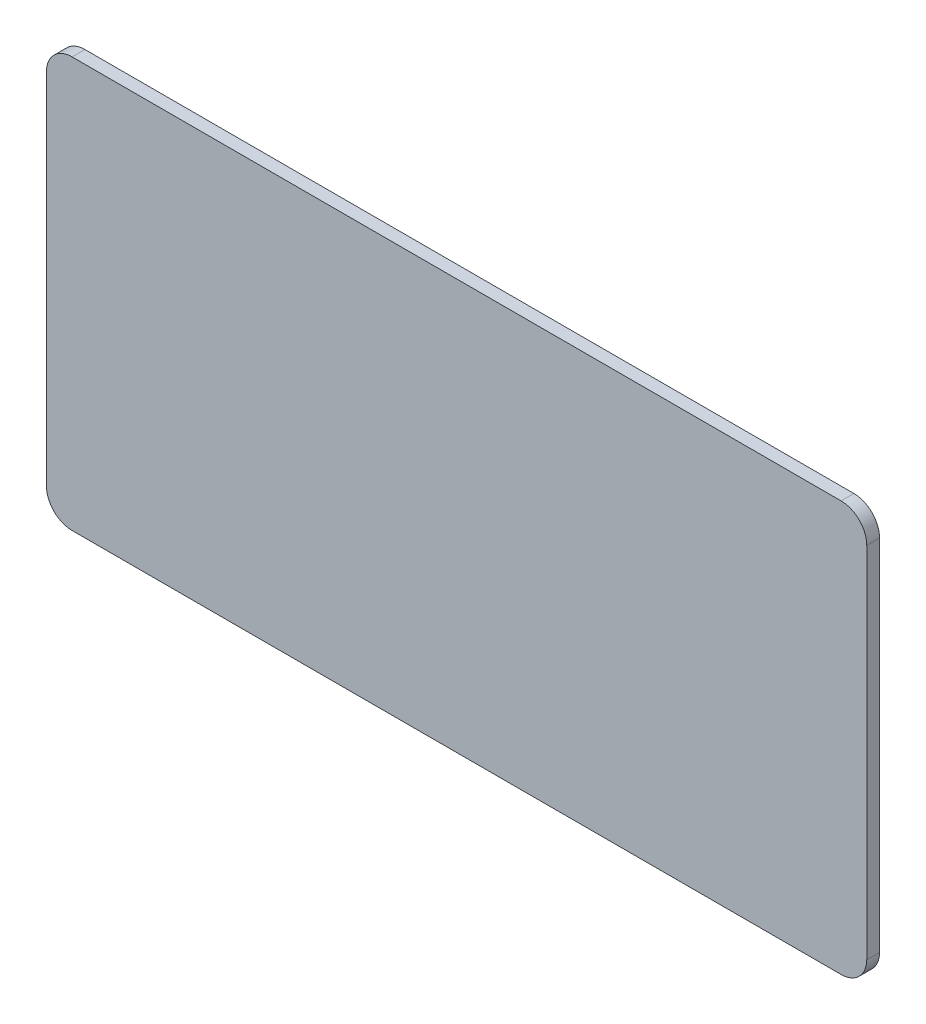
from build123d import *

# Parameters (mm, degrees)
BOSS_EXTRUDE2_DEPTH = 5


with BuildPart() as part:
    # Sketch3 → Boss-Extrude2 (new body)
    with BuildSketch(Plane.XY):
        with BuildLine():
            Line((-150, 80), (150, 80))
            ThreePointArc((150, 80), (157.071067812, 77.071067812), (160, 70))
            Line((160, 70), (160, -70))
            ThreePointArc((160, -70), (157.071067812, -77.071067812), (150, -80))
            Line((150, -80), (-150, -80))
            ThreePointArc((-150, -80), (-157.071067812, -77.071067812), (-160, -70))
            Line((-160, -70), (-160, 70))
            ThreePointArc((-160, 70), (-157.071067812, 77.071067812), (-150, 80))
        make_face()
    extrude(amount=-BOSS_EXTRUDE2_DEPTH)


solid = part.part
